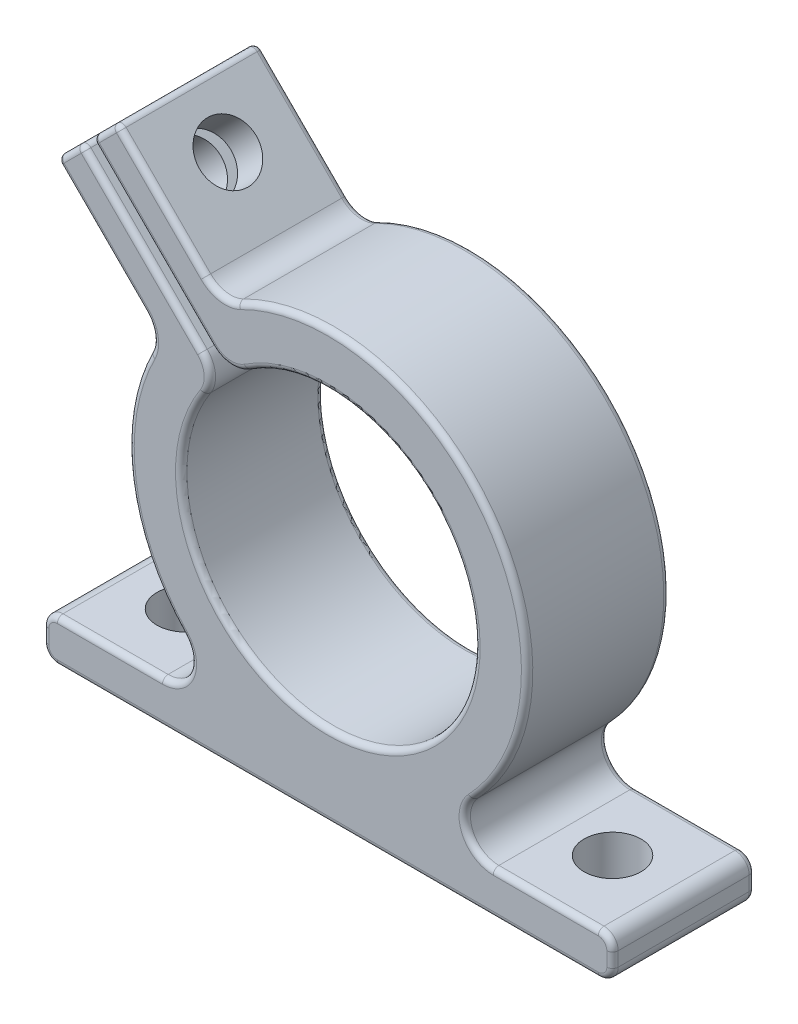
from build123d import *

# Parameters (mm, degrees)
EXTRUDE_1_DEPTH     = 5
CUT_EXTRUDE_1_REACH = 21.489
SKETCH_3_R          = 1
FILLET_2_R          = 0.2
SKETCH_5_R          = 1
CUT_EXTRUDE_3_DEPTH = 10


with BuildPart() as part:
    # 草图1 → 凸台-拉伸1 (new body)
    with BuildSketch(Plane.XY):
        with BuildLine():
            Line((-9.5, -6.5), (-5.809475019, -6.5))
            ThreePointArc((-5.809475019, -6.5), (-4.890916366, -5.895284708), (-5.083290642, -4.8125))
            ThreePointArc((-5.083290642, -4.8125), (-6.926305331, -1.013061924), (-6.24864911, 3.155056942))
            ThreePointArc((-6.24864911, 3.155056942), (-6.153913207, 3.764023225), (-6.434206487, 4.312886143))
            Line((-6.434206487, 4.312886143), (-9.40452019, 7.283199846))
            ThreePointArc((-9.40452019, 7.283199846), (-9.463098834, 7.424621202), (-9.40452019, 7.566042559))
            Line((-9.40452019, 7.566042559), (-8.803479426, 8.167083323))
            ThreePointArc((-8.803479426, 8.167083323), (-8.66205807, 8.225661966), (-8.520636713, 8.167083323))
            Line((-8.520636713, 8.167083323), (-4.434710467, 4.081157076))
            ThreePointArc((-4.434710467, 4.081157076), (-4.147049322, 3.476210822), (-4.305749403, 2.825424231))
            ThreePointArc((-4.305749403, 2.825424231), (3.641599923, -3.641599923), (-2.825424231, 4.305749403))
            ThreePointArc((-2.825424231, 4.305749403), (-3.476210822, 4.147049322), (-4.081157076, 4.434710467))
            Line((-4.081157076, 4.434710467), (-8.167083323, 8.520636713))
            ThreePointArc((-8.167083323, 8.520636713), (-8.225661966, 8.66205807), (-8.167083323, 8.803479426))
            Line((-8.167083323, 8.803479426), (-7.566042559, 9.40452019))
            ThreePointArc((-7.566042559, 9.40452019), (-7.424621202, 9.463098834), (-7.283199846, 9.40452019))
            Line((-7.283199846, 9.40452019), (-4.312886143, 6.434206487))
            ThreePointArc((-4.312886143, 6.434206487), (-3.764023225, 6.153913207), (-3.155056942, 6.24864911))
            ThreePointArc((-3.155056942, 6.24864911), (5.613980424, 4.181294512), (5.083290642, -4.8125))
            ThreePointArc((5.083290642, -4.8125), (4.890916366, -5.895284708), (5.809475019, -6.5))
            Line((5.809475019, -6.5), (9.5, -6.5))
            ThreePointArc((9.5, -6.5), (9.853553391, -6.646446609), (10, -7))
            Line((10, -7), (10, -7.5))
            ThreePointArc((10, -7.5), (9.853553391, -7.853553391), (9.5, -8))
            Line((9.5, -8), (-9.5, -8))
            ThreePointArc((-9.5, -8), (-9.853553391, -7.853553391), (-10, -7.5))
            Line((-10, -7.5), (-10, -7))
            ThreePointArc((-10, -7), (-9.853553391, -6.646446609), (-9.5, -6.5))
        make_face()
    extrude(amount=EXTRUDE_1_DEPTH)

    # 草图3 → 切除-拉伸1 (cut, up to next)
    with BuildSketch(Plane(origin=(0, -6.5, 0), x_dir=(1, 0, 0), z_dir=(0, 1, 0)), mode=Mode.PRIVATE) as cut_extrude_1_sk1:
        with Locations(Location((-7.5, -2.5, 0), (0, 0, 270))):
            Circle(SKETCH_3_R)
    cut_extrude_1_tool1 = extrude(cut_extrude_1_sk1.sketch, amount=-CUT_EXTRUDE_1_REACH, mode=Mode.PRIVATE) & part.part
    # 草图3 → 切除-拉伸1 (cut, up to next)
    with BuildSketch(Plane(origin=(0, -6.5, 0), x_dir=(1, 0, 0), z_dir=(0, 1, 0)), mode=Mode.PRIVATE) as cut_extrude_1_sk2:
        with Locations(Location((7.5, -2.5, 0), (0, 0, 270))):
            Circle(SKETCH_3_R)
    cut_extrude_1_tool2 = extrude(cut_extrude_1_sk2.sketch, amount=-CUT_EXTRUDE_1_REACH, mode=Mode.PRIVATE) & part.part
    add(cut_extrude_1_tool1.solids().sort_by_distance((-7.5, -6.5, 2.5))[0], mode=Mode.SUBTRACT)
    add(cut_extrude_1_tool2.solids().sort_by_distance((7.5, -6.5, 2.5))[0], mode=Mode.SUBTRACT)

    # 圆角2
    fillet_2_edges = [part.edges().sort_by_distance(p)[0] for p in [
        (-3.764023225, 6.153913207, 5),
        (-5.798042995, 7.919363338, 5),
        (-7.424621202, 9.463098834, 5),
        (-7.866562941, 9.103999808, 5),
        (-8.225661966, 8.66205807, 5),
        (7.65473751, -6.5, 0),
        (9.853553391, -6.646446609, 0),
        (10, -7.25, 0),
        (9.853553391, -7.853553391, 0),
        (-6.124120199, 6.47767359, 5),
        (0, -8, 0),
        (-9.853553391, -7.853553391, 0),
        (-10, -7.25, 0),
        (-9.853553391, -6.646446609, 0),
        (-7.65473751, -6.5, 0),
        (-4.890916366, -5.895284708, 0),
        (-6.926305331, -1.013061924, 0),
        (-3.476210822, 4.147049322, 5),
        (-6.153913207, 3.764023225, 0),
        (-7.919363338, 5.798042995, 0),
        (-9.463098834, 7.424621202, 0),
        (-9.103999808, 7.866562941, 0),
        (-8.66205807, 8.225661966, 0),
        (-6.47767359, 6.124120199, 0),
        (-4.147049322, 3.476210822, 0),
        (3.641599923, -3.641599923, 0),
        (3.641599923, -3.641599923, 5),
        (-3.476210822, 4.147049322, 0),
        (-6.124120199, 6.47767359, 0),
        (-8.225661966, 8.66205807, 0),
        (-7.866562941, 9.103999808, 0),
        (-7.424621202, 9.463098834, 0),
        (-5.798042995, 7.919363338, 0),
        (-3.764023225, 6.153913207, 0),
        (-4.147049322, 3.476210822, 5),
        (5.613980424, 4.181294512, 0),
        (4.890916366, -5.895284708, 0),
        (-6.47767359, 6.124120199, 5),
        (4.890916366, -5.895284708, 5),
        (-8.66205807, 8.225661966, 5),
        (-9.103999808, 7.866562941, 5),
        (-9.463098834, 7.424621202, 5),
        (-7.919363338, 5.798042995, 5),
        (-6.153913207, 3.764023225, 5),
        (-6.926305331, -1.013061924, 5),
        (-4.890916366, -5.895284708, 5),
        (-7.65473751, -6.5, 5),
        (-9.853553391, -6.646446609, 5),
        (-10, -7.25, 5),
        (5.613980424, 4.181294512, 5),
        (-9.853553391, -7.853553391, 5),
        (0, -8, 5),
        (9.853553391, -7.853553391, 5),
        (10, -7.25, 5),
        (9.853553391, -6.646446609, 5),
        (7.65473751, -6.5, 5),
    ]]
    fillet(fillet_2_edges, radius=FILLET_2_R)

    # 草图5 → 切除-拉伸3 (cut)
    with BuildSketch(Plane(origin=(-1.060660172, -1.060660172, 0), x_dir=(0, 0, 1), z_dir=(-0.7071067811865477, -0.7071067811865475, 0))):
        with Locations(Location((2.5, 10, 0), (0, 0, 270))):
            Circle(SKETCH_5_R)
    extrude(amount=-CUT_EXTRUDE_3_DEPTH, mode=Mode.SUBTRACT)


solid = part.part
